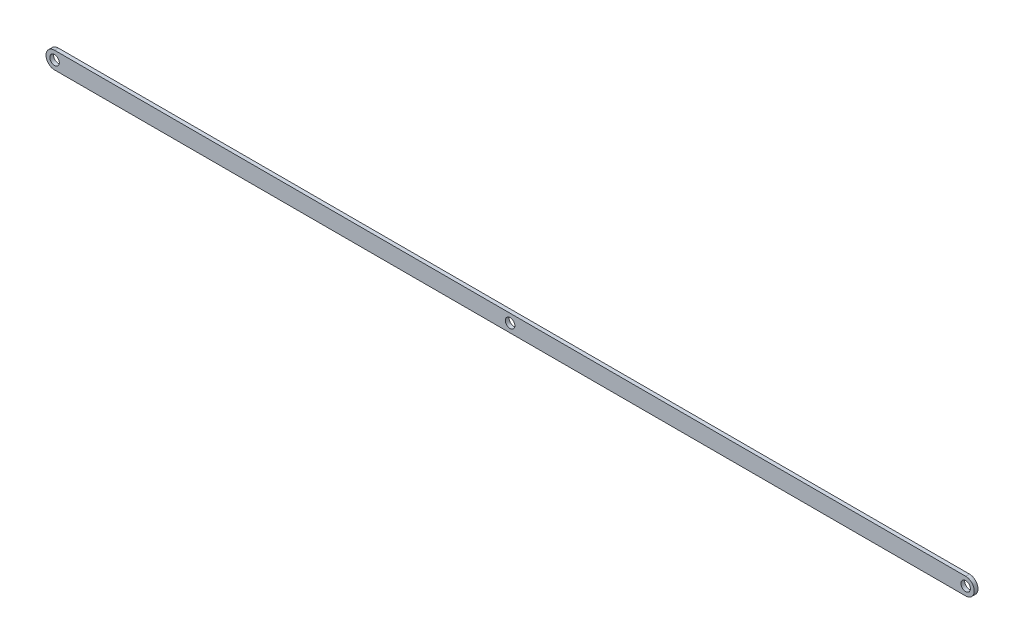
from build123d import *

# Parameters (mm, degrees)
SKETCH1_R           = 46.875
BOSS_EXTRUDE1_DEPTH = 37.5


with BuildPart() as part:
    # Sketch1 → Boss-Extrude1 (new body)
    with BuildSketch(Plane.XY):
        with BuildLine():
            Line((-4500, 84.375), (4500, 84.375))
            ThreePointArc((4500, 84.375), (4584.375, 0), (4500, -84.375))
            Line((4500, -84.375), (-4500, -84.375))
            ThreePointArc((-4500, -84.375), (-4584.375, 0), (-4500, 84.375))
        make_face()
        with Locations((-4500, 0)):
            Circle(SKETCH1_R, mode=Mode.SUBTRACT)
        Circle(SKETCH1_R, mode=Mode.SUBTRACT)
        with Locations((4500, 0)):
            Circle(SKETCH1_R, mode=Mode.SUBTRACT)
    extrude(amount=BOSS_EXTRUDE1_DEPTH)


solid = part.part
